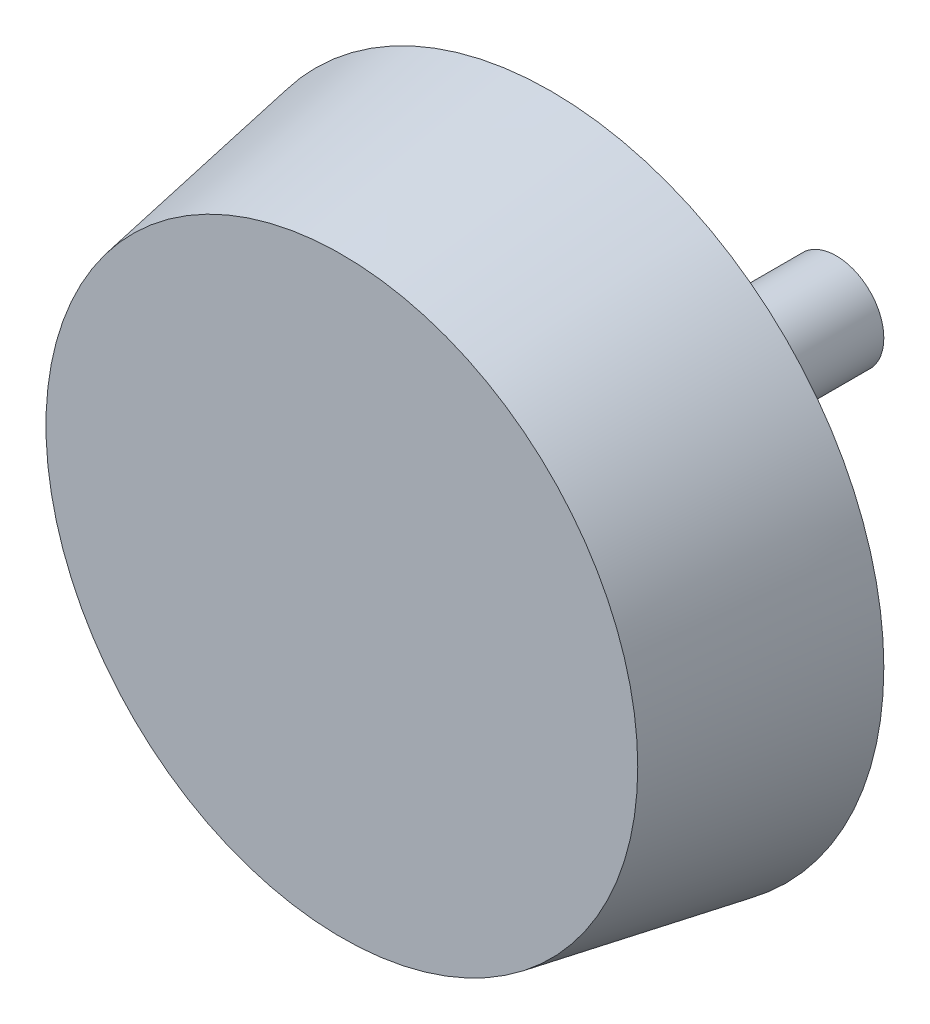
from build123d import *

# Parameters (mm, degrees)
SKETCH_2_R      = 35
EXTRUDE_1_DEPTH = 22
EXTRUDE_1_TAPER = 10
SKETCH_3_R      = 5
EXTRUDE_2_DEPTH = 30


with BuildPart() as part:
    # Эскиз2 → Бобышка-Вытянуть1 (new body)
    with BuildSketch(Plane.XY):
        Circle(SKETCH_2_R)
    extrude(amount=EXTRUDE_1_DEPTH, taper=EXTRUDE_1_TAPER)

    # Эскиз3 → Бобышка-Вытянуть2 (add)
    with BuildSketch(Plane(origin=(0, 0, 0), x_dir=(-1, 0, 0), z_dir=(0, 0, -1))):
        with Locations(Location((0, 0, 0), (0, 0, 180))):
            Circle(SKETCH_3_R)
    extrude(amount=EXTRUDE_2_DEPTH)


solid = part.part
